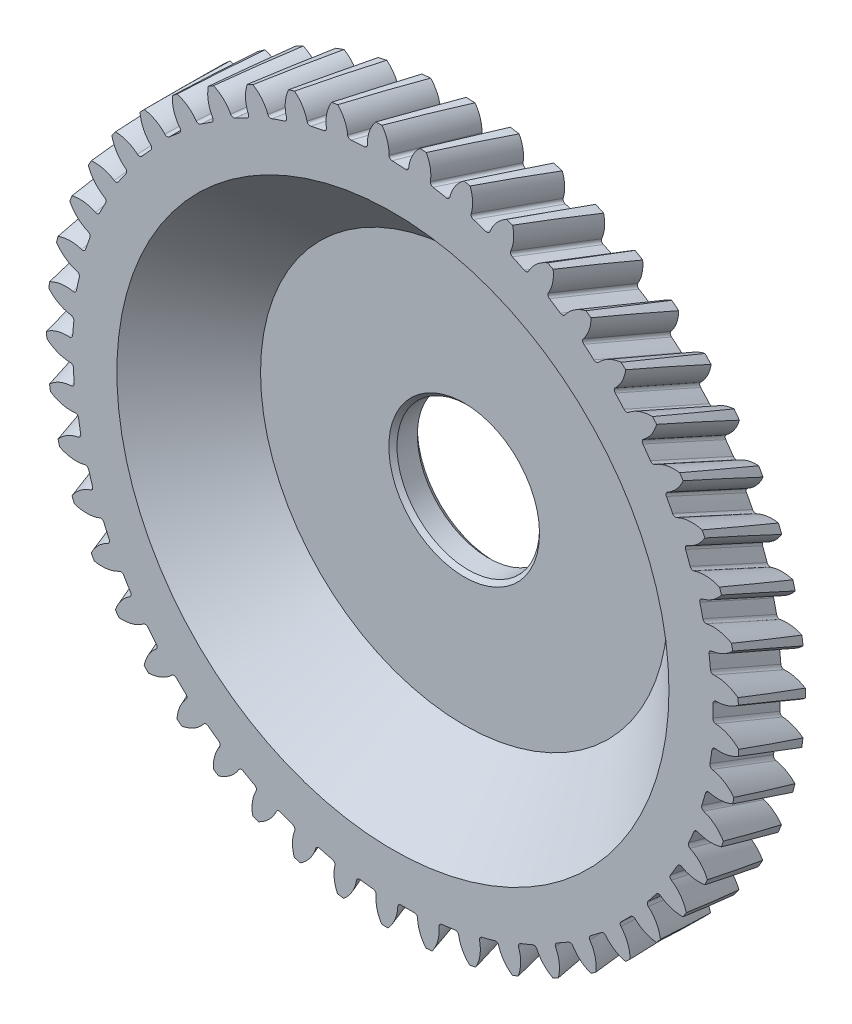
from build123d import *

# Parameters (mm, degrees)
ENL_V_MAT_EXTRU_1_DEPTH      = 12.5
R_P_TITION_CIRCULAIRE1_COUNT = 49
R_P_TITION_CIRCULAIRE1_ANGLE = 352.656


with BuildPart() as part:
    # Esquisse1 → Révolution1 (revolve)
    with BuildSketch(Plane(origin=(0, 0, 0), x_dir=(0, 0, -1), z_dir=(1, 0, 0))):
        Polygon((6, 19.94399568), (2.5, 23.5), (2.5, 34), (-4, 34), (-4, 27.11200864), (3, 20), (3, 7.4), (3.4, 7), (5.4, 7), (6, 7.6), align=None)
    revolve(axis=Axis((0, 0, 22.79904), (0, 0, -1)))

    # Esquisse3 → Enlèv. mat.-Extru.1 (cut, symmetric)
    with BuildSketch(Plane(origin=(-1.521856046, 0, 3.766725893), x_dir=(-0.9271838545667884, 0, -0.37460659341590974), z_dir=(0.37460659341590974, 0, -0.9271838545667884))):
        with BuildLine():
            Line((-0.364987729, 34.166171522), (-0.450994837, 34.608493793))
            Line((-0.450994837, 34.608493793), (-4.007118114, 34.166171522))
            Line((-4.007118114, 34.166171522), (-4.007118114, 33.932337039))
            ThreePointArc((-4.007118114, 33.932337039), (-3.27186607, 32.891885896), (-2.936382885, 31.662827239))
            ThreePointArc((-2.936382885, 31.662827239), (-2.830420008, 31.460548137), (-2.612771066, 31.391454687))
            ThreePointArc((-2.612771066, 31.391454687), (-2.018228725, 31.435278793), (-1.422963501, 31.467843505))
            ThreePointArc((-1.422963501, 31.467843505), (-1.215937031, 31.564202249), (-1.136711213, 31.778370959))
            ThreePointArc((-1.136711213, 31.778370959), (-0.961152222, 33.040239887), (-0.364987729, 34.166171522))
        make_face()
    enl_v_mat_extru_1 = extrude(amount=ENL_V_MAT_EXTRU_1_DEPTH, both=True, mode=Mode.SUBTRACT)

    # Répétition circulaire1: Enlèv. mat.-Extru.1 ×49 about axis
    r_p_tition_circulaire1_axis = Axis((0, 0, 22.79904), (0, 0, -1))
    for i in range(1, R_P_TITION_CIRCULAIRE1_COUNT):
        add(enl_v_mat_extru_1.rotate(r_p_tition_circulaire1_axis, i * R_P_TITION_CIRCULAIRE1_ANGLE / (R_P_TITION_CIRCULAIRE1_COUNT - 1)), mode=Mode.SUBTRACT)


solid = part.part
